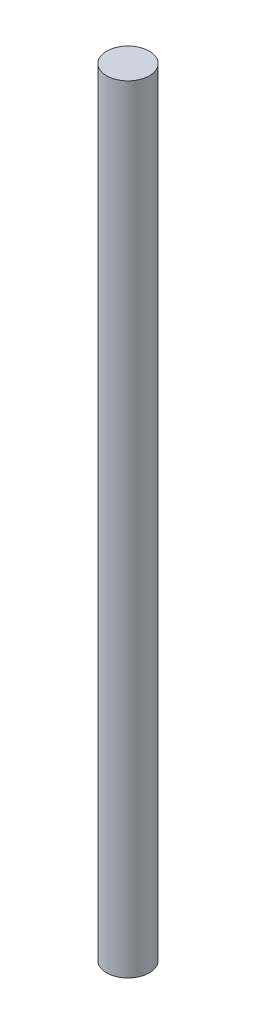
from build123d import *

# Parameters (mm, degrees)
SKETCH1_R           = 2.75
BOSS_EXTRUDE1_DEPTH = 100


with BuildPart() as part:
    # Sketch1 → Boss-Extrude1 (new body)
    with BuildSketch(Plane(origin=(0, 0, 0), x_dir=(1, 0, 0), z_dir=(0, 1, 0))):
        with Locations(Location((0, 0, 0), (0, 0, 270))):
            Circle(SKETCH1_R)
    extrude(amount=BOSS_EXTRUDE1_DEPTH)


solid = part.part
